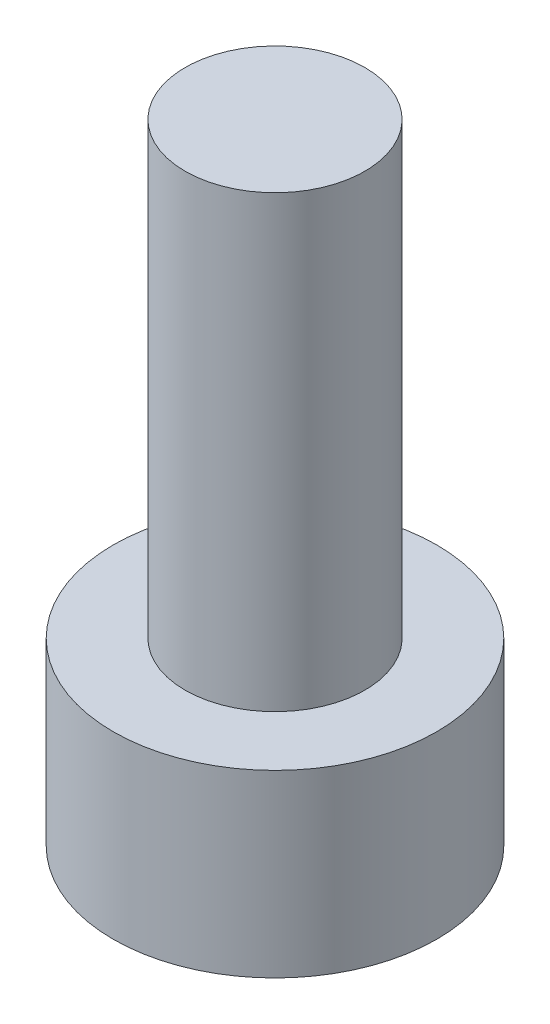
from build123d import *

# Parameters (mm, degrees)
SKETCH1_R           = 1.27
BOSS_EXTRUDE1_DEPTH = 6.35
SKETCH2_R           = 2.286
BOSS_EXTRUDE2_DEPTH = 2.54
CUT_EXTRUDE1_DEPTH  = 1.778


with BuildPart() as part:
    # Sketch1 → Boss-Extrude1 (new body)
    with BuildSketch(Plane(origin=(0, 0, 0), x_dir=(1, 0, 0), z_dir=(0, 1, 0))):
        with Locations(Location((0, 0, 0), (0, 0, 270))):
            Circle(SKETCH1_R)
    extrude(amount=BOSS_EXTRUDE1_DEPTH)

    # Sketch2 → Boss-Extrude2 (add)
    with BuildSketch(Plane.XZ):
        with Locations(Location((0, 0, 0), (0, 0, 270))):
            Circle(SKETCH2_R)
    extrude(amount=BOSS_EXTRUDE2_DEPTH)

    # Sketch3 → Cut-Extrude1 (cut)
    with BuildSketch(Plane(origin=(0, -2.54, 0), x_dir=(-1, 0, 0), z_dir=(0, -1, 0))):
        Polygon((-0.068044734, 1.850241436), (-1.636378453, 0.86619225), (-1.56833372, -0.984049186), (0.068044734, -1.850241436), (1.636378453, -0.86619225), (1.56833372, 0.984049186), align=None)
    extrude(amount=-CUT_EXTRUDE1_DEPTH, mode=Mode.SUBTRACT)


solid = part.part
